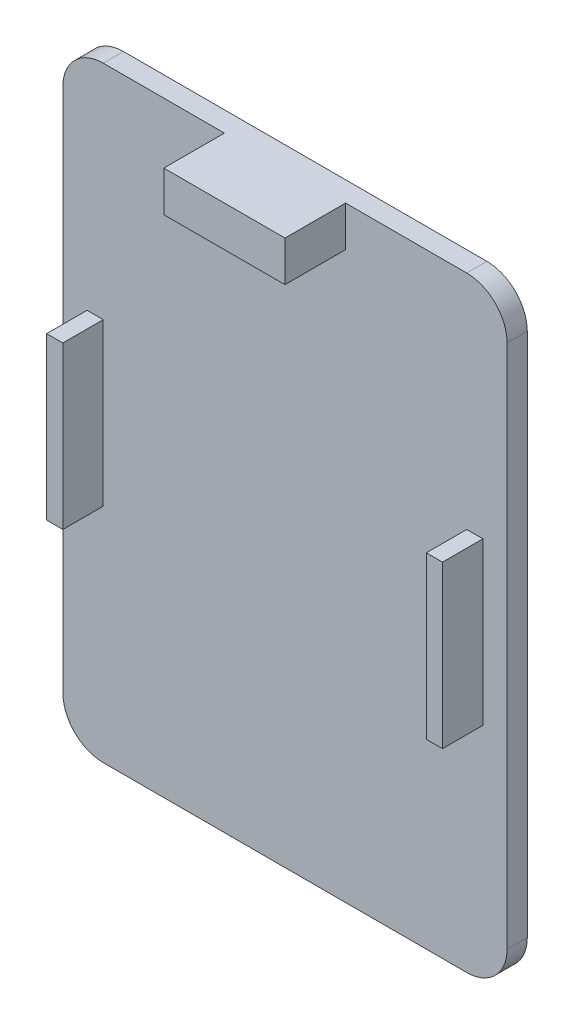
from build123d import *

# Parameters (mm, degrees)
BOSS_EXTRUDE1_DEPTH = 0.5
SKETCH2_W           = 3
SKETCH2_H           = 1
BOSS_EXTRUDE2_DEPTH = 1.5
SKETCH3_W           = 0.4
SKETCH3_H           = 4
BOSS_EXTRUDE3_DEPTH = 1


with BuildPart() as part:
    # Sketch1 → Boss-Extrude1 (new body)
    with BuildSketch(Plane.XY):
        with BuildLine():
            Line((-4.5, -7.5), (4.5, -7.5))
            ThreePointArc((4.5, -7.5), (5.207106781, -7.207106781), (5.5, -6.5))
            Line((5.5, -6.5), (5.5, 6.5))
            ThreePointArc((5.5, 6.5), (5.207106781, 7.207106781), (4.5, 7.5))
            Line((4.5, 7.5), (-4.5, 7.5))
            ThreePointArc((-4.5, 7.5), (-5.207106781, 7.207106781), (-5.5, 6.5))
            Line((-5.5, 6.5), (-5.5, -6.5))
            ThreePointArc((-5.5, -6.5), (-5.207106781, -7.207106781), (-4.5, -7.5))
        make_face()
    extrude(amount=BOSS_EXTRUDE1_DEPTH)

    # Sketch2 → Boss-Extrude2 (add)
    with BuildSketch(Plane.XY.offset(0.5)):
        with Locations((0, 7)):
            Rectangle(SKETCH2_W, SKETCH2_H)
    extrude(amount=BOSS_EXTRUDE2_DEPTH)

    # Sketch3 → Boss-Extrude3 (add)
    with BuildSketch(Plane.XY.offset(0.5)):
        with Locations((-4.7, 0)):
            Rectangle(SKETCH3_W, SKETCH3_H)
    boss_extrude3 = extrude(amount=BOSS_EXTRUDE3_DEPTH)

    # Mirror2: Boss-Extrude3 across plane
    add(boss_extrude3.mirror(Plane(origin=(0, 0, 0), x_dir=(0, 0, 1), z_dir=(1, 0, 0))))


solid = part.part
